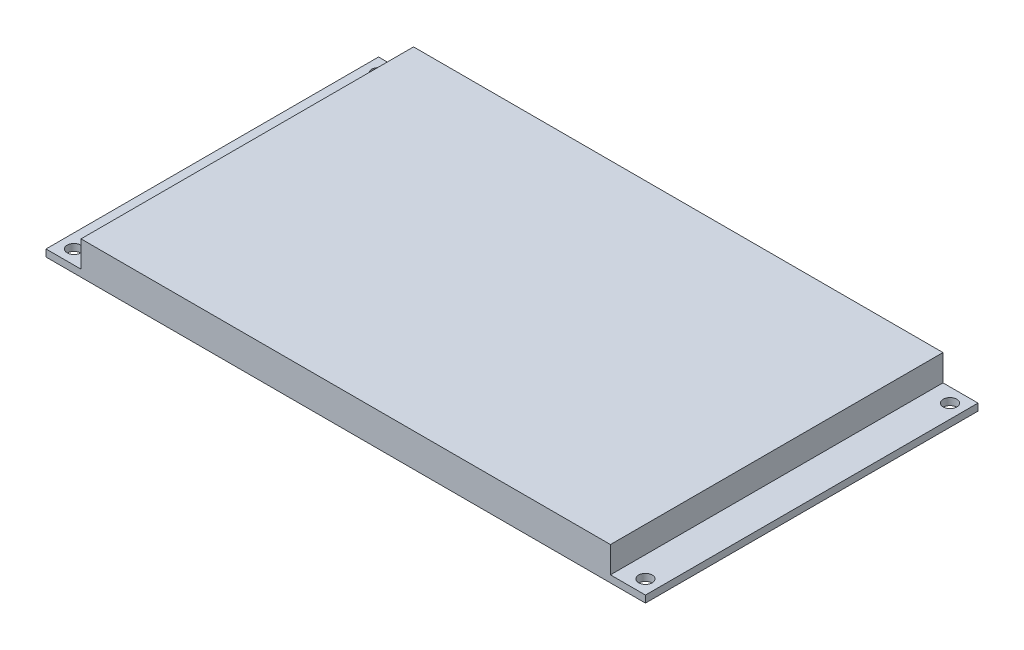
from build123d import *

# Parameters (mm, degrees)
SKETCH_1_W          = 137
SKETCH_1_H          = 76
EXTRUDE_1_DEPTH     = 1.6
SKETCH_2_W          = 121
SKETCH_2_H          = 76
EXTRUDE_2_DEPTH     = 6
SKETCH_3_R          = 1.55
CUT_EXTRUDE_1_DEPTH = 5.6


with BuildPart() as part:
    # 草图1 → 凸台-拉伸1 (new body)
    with BuildSketch(Plane(origin=(0, 0, 0), x_dir=(1, 0, 0), z_dir=(0, 1, 0))):
        with Locations((68.5, -38)):
            Rectangle(SKETCH_1_W, SKETCH_1_H)
    extrude(amount=EXTRUDE_1_DEPTH)

    # 草图2 → 凸台-拉伸2 (add)
    with BuildSketch(Plane(origin=(0, 1.6, 0), x_dir=(1, 0, 0), z_dir=(0, 1, 0))):
        with Locations((68.5, -38)):
            Rectangle(SKETCH_2_W, SKETCH_2_H)
    extrude(amount=EXTRUDE_2_DEPTH)

    # 草图3 → 切除-拉伸1 (cut)
    with BuildSketch(Plane(origin=(0, 1.6, 0), x_dir=(1, 0, 0), z_dir=(0, 1, 0))):
        with Locations(Location((3.2, -3.2, 0), (0, 0, 270))):
            Circle(SKETCH_3_R)
        with Locations(Location((3.2, -72.8, 0), (0, 0, 270))):
            Circle(SKETCH_3_R)
        with Locations(Location((133.8, -3.2, 0), (0, 0, 270))):
            Circle(SKETCH_3_R)
        with Locations(Location((133.8, -72.8, 0), (0, 0, 270))):
            Circle(SKETCH_3_R)
    extrude(amount=-CUT_EXTRUDE_1_DEPTH, mode=Mode.SUBTRACT)


solid = part.part
